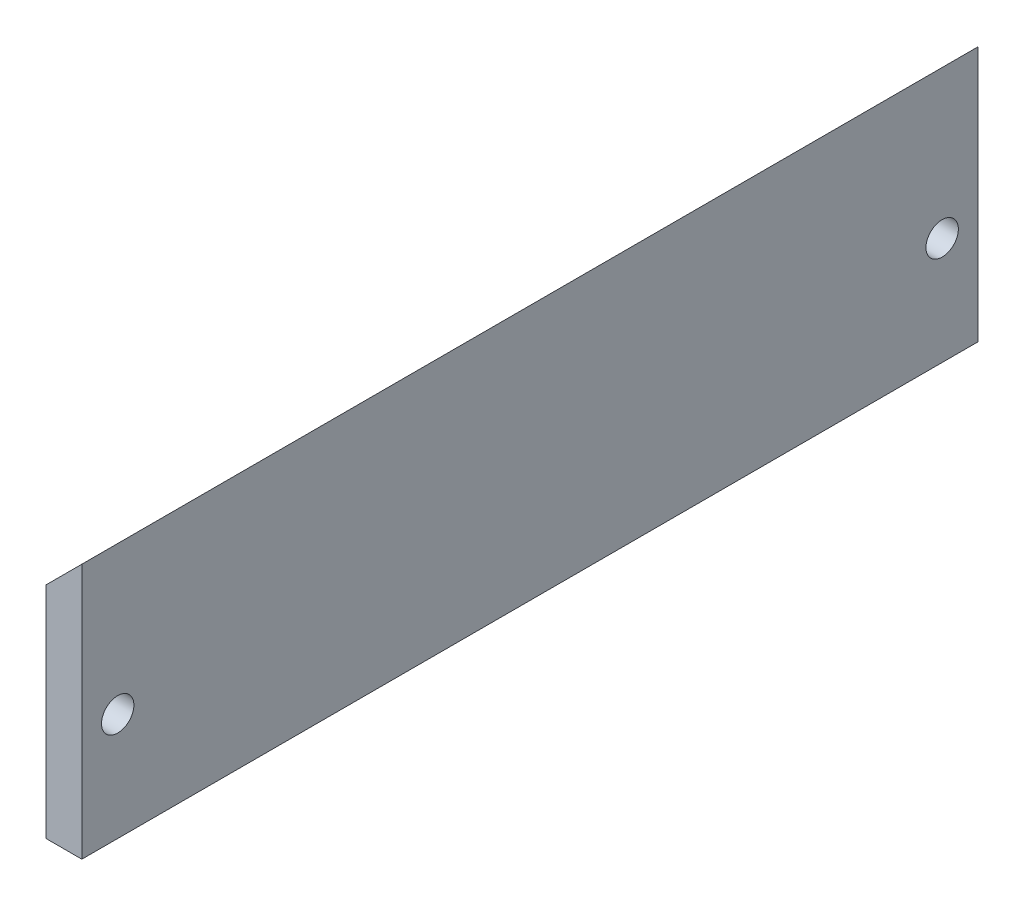
from build123d import *

# Parameters (mm, degrees)
SKETCH1_W                 = 39.6875
SKETCH1_H                 = 22.6314
SKETCH1_R                 = 1.4351
BOSS_EXTRUDE1_DEPTH       = 6.35
SKETCH2_W                 = 3.175
SKETCH2_H                 = 6.35
CUT_EXTRUDE1_DEPTH        = 47.125919202
CUT_EXTRUDE2_DEPTH        = 47.125919202
F_4_40_TAPPED_HOLE1_D     = 2.2606
F_4_40_TAPPED_HOLE1_DEPTH = 9.652
F_4_40_TAPPED_HOLE1_TIP   = 0.679152758


with BuildPart() as part:
    # Sketch1 → Boss-Extrude1 (new body)
    with BuildSketch(Plane(origin=(0, 0, 0), x_dir=(0, 0, -1), z_dir=(1, 0, 0))):
        with Locations((19.84375, 11.3157)):
            Rectangle(SKETCH1_W, SKETCH1_H)
        with Locations((36.5125, 9.525)):
            Circle(SKETCH1_R, mode=Mode.SUBTRACT)
    extrude(amount=-BOSS_EXTRUDE1_DEPTH)

    # Sketch2 → Cut-Extrude1 (cut, through all)
    with BuildSketch(Plane.XZ):
        with Locations((-4.7625, -36.5125)):
            Rectangle(SKETCH2_W, SKETCH2_H)
    extrude(amount=-CUT_EXTRUDE1_DEPTH, mode=Mode.SUBTRACT)

    # Sketch3 → Cut-Extrude2 (cut, through all)
    with BuildSketch(Plane.XY):
        Polygon((0, 22.6314), (-6.35, 16.2814), (-6.35, 22.6314), align=None)
    extrude(amount=-CUT_EXTRUDE2_DEPTH, mode=Mode.SUBTRACT)

    # #4-40 Tapped Hole1
    with Locations(Plane.XZ):
        with Locations((-3.175, -20.6375)):
            Hole(F_4_40_TAPPED_HOLE1_D / 2, depth=F_4_40_TAPPED_HOLE1_DEPTH)
            with Locations((0, 0, -(F_4_40_TAPPED_HOLE1_DEPTH + F_4_40_TAPPED_HOLE1_TIP / 2))):  # 118° drill point
                Cone(0, F_4_40_TAPPED_HOLE1_D / 2, F_4_40_TAPPED_HOLE1_TIP, mode=Mode.SUBTRACT)

    # Mirror1: part across plane


with BuildPart() as part_1:
    add(part.part)
    add(part.part.mirror(Plane(origin=(-6.35, 0, 0), x_dir=(1, 0, 0), z_dir=(0, 0, 1))))


solid = part_1.part
